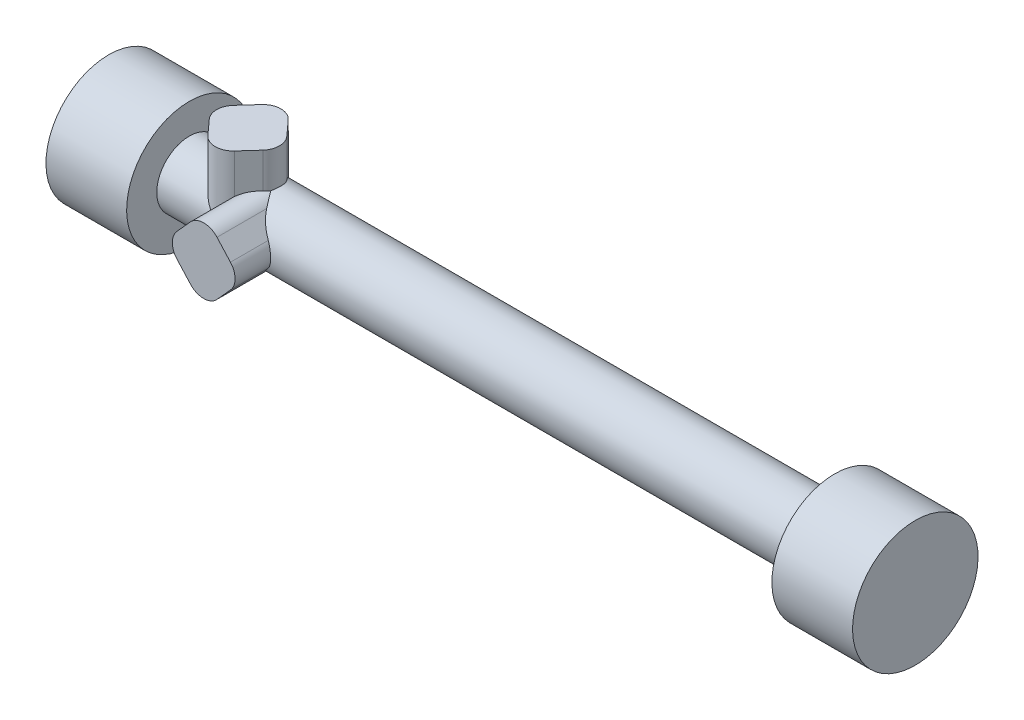
from build123d import *

# Parameters (mm, degrees)
BOSS_EXTRUDE1_DEPTH = 38
BOSS_EXTRUDE2_DEPTH = 38


with BuildPart() as part:
    # Sketch1 → Revolve1 (revolve)
    with BuildSketch(Plane.XY):
        Polygon((-41.446882046, 0), (-41.446882046, 35), (3.553117954, 35), (3.553117954, 18.2), (363.553117954, 18.2), (363.553117954, 35), (408.553117954, 35), (408.553117954, 0), align=None)
    revolve(axis=Axis((408.553117954, 0, 0), (-1, 0, 0)))

    # Sketch2 → Boss-Extrude1 (add)
    with BuildSketch(Plane.XY):
        with BuildLine():
            Line((34.62755495, 6.710806587), (42.139274487, 15.00946817))
            ThreePointArc((42.139274487, 15.00946817), (49.553117954, 18.298661583), (56.966961421, 15.00946817))
            Line((56.966961421, 15.00946817), (64.478680957, 6.710806587))
            ThreePointArc((64.478680957, 6.710806587), (67.06483749, 0), (64.478680957, -6.710806587))
            Line((64.478680957, -6.710806587), (56.966961421, -15.00946817))
            ThreePointArc((56.966961421, -15.00946817), (49.553117954, -18.298661583), (42.139274487, -15.00946817))
            Line((42.139274487, -15.00946817), (34.62755495, -6.710806587))
            ThreePointArc((34.62755495, -6.710806587), (32.041398417, 0), (34.62755495, 6.710806587))
        make_face()
    extrude(amount=BOSS_EXTRUDE1_DEPTH)

    # Sketch4 → Boss-Extrude2 (add)
    with BuildSketch(Plane(origin=(0, 0, 0), x_dir=(1, 0, 0), z_dir=(0, 1, 0))):
        with BuildLine():
            Line((20.785581303, 7.29733528), (28.297300839, 15.595996863))
            ThreePointArc((28.297300839, 15.595996863), (35.711144306, 18.885190277), (43.124987774, 15.595996863))
            Line((43.124987774, 15.595996863), (50.63670731, 7.29733528))
            ThreePointArc((50.63670731, 7.29733528), (53.222863843, 0.586528694), (50.63670731, -6.124277893))
            Line((50.63670731, -6.124277893), (43.124987774, -14.422939476))
            ThreePointArc((43.124987774, -14.422939476), (35.711144306, -17.712132889), (28.297300839, -14.422939476))
            Line((28.297300839, -14.422939476), (20.785581303, -6.124277893))
            ThreePointArc((20.785581303, -6.124277893), (18.19942477, 0.586528694), (20.785581303, 7.29733528))
        make_face()
    extrude(amount=BOSS_EXTRUDE2_DEPTH)


solid = part.part
